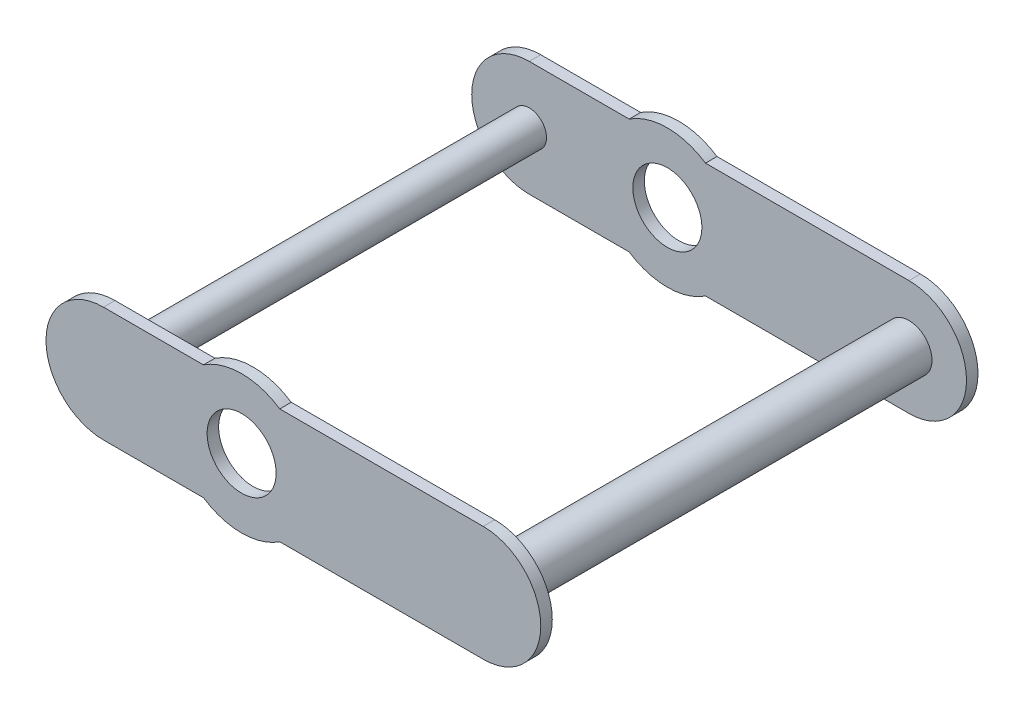
from build123d import *

# Parameters (mm, degrees)
SKETCH1_R           = 38.1
BOSS_EXTRUDE1_DEPTH = 241.3
SKETCH3_R           = 330.2
SKETCH3_R_2         = 19.05
SKETCH3_R_3         = 25.4
SKETCH3_R_4         = 15.875
CUT_EXTRUDE1_DEPTH  = 228.6


with BuildPart() as part:
    # Sketch1 → Boss-Extrude1 (new, symmetric)
    with BuildSketch(Plane.XY):
        with BuildLine():
            Line((-152.4, 63.5), (-42.121134838, 63.5))
            ThreePointArc((-42.121134838, 63.5), (0, 76.2), (42.121134838, 63.5))
            Line((42.121134838, 63.5), (266.7, 63.5))
            ThreePointArc((266.7, 63.5), (330.2, 0), (266.7, -63.5))
            Line((266.7, -63.5), (42.121134838, -63.5))
            ThreePointArc((42.121134838, -63.5), (0, -76.2), (-42.121134838, -63.5))
            Line((-42.121134838, -63.5), (-152.4, -63.5))
            ThreePointArc((-152.4, -63.5), (-215.9, 0), (-152.4, 63.5))
        make_face()
        Circle(SKETCH1_R, mode=Mode.SUBTRACT)
    extrude(amount=BOSS_EXTRUDE1_DEPTH, both=True)

    # Sketch3 → Cut-Extrude1 (cut, symmetric)
    # profile 1 of 2: a face of its own
    with BuildSketch(Plane.XY):
        Circle(SKETCH3_R)
        with Locations((-152.4, 0)):
            Circle(SKETCH3_R_2, mode=Mode.SUBTRACT)
        with Locations((266.7, 0)):
            Circle(SKETCH3_R_3, mode=Mode.SUBTRACT)
    # profile 2 of 2: a face of its own
    with BuildSketch(Plane.XY):
        with Locations((-152.4, 0)):
            Circle(SKETCH3_R_4)
    extrude(amount=CUT_EXTRUDE1_DEPTH, both=True, mode=Mode.SUBTRACT)


solid = part.part
